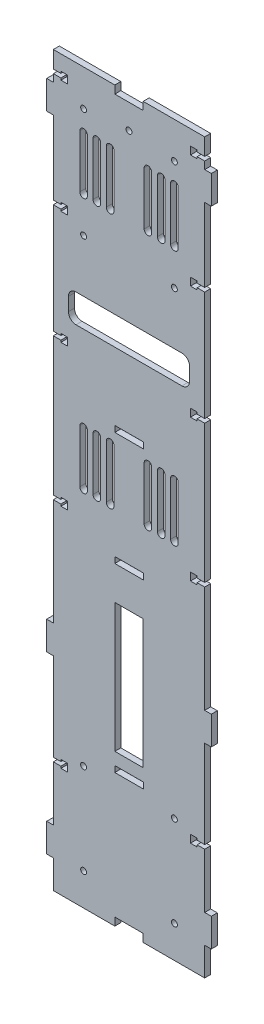
from build123d import *

# Parameters (mm, degrees)
SKETCH1_W                = 80
SKETCH1_H                = 385
BOSS_EXTRUDE1_DEPTH      = 3.175
SKETCH2_W                = 3.5
SKETCH2_H                = 15
BOSS_EXTRUDE2_DEPTH      = 3.175
CUT_EXTRUDE1_DEPTH       = 3.175
LPATTERN1_COUNT          = 2
LPATTERN1_PITCH          = 60
LPATTERN2_COUNT          = 2
LPATTERN2_PITCH          = 120
LPATTERN3_COUNT          = 2
LPATTERN3_PITCH          = 195
LPATTERN6_COUNT          = 2
LPATTERN6_PITCH          = 315
MIRROR2_COPY_1_DEPTH     = 3.175
MIRROR2_COPY_2_DEPTH     = 3.175
MIRROR2_COPY_3_DEPTH     = 3.175
MIRROR2_COPY_4_DEPTH     = 3.175
SKETCH7_W                = 15
SKETCH7_H                = 4.175
CUT_EXTRUDE2_DEPTH       = 10
SKETCH8_W                = 15
SKETCH8_H                = 3.175
CUT_EXTRUDE3_DEPTH       = 10
SKETCH9_W                = 15.1
SKETCH9_H                = 3.2
CUT_EXTRUDE4_DEPTH       = 350.137982215
SKETCH10_R               = 1.55
CUT_EXTRUDE5_DEPTH       = 10
SKETCH11_R               = 1.55
CUT_EXTRUDE6_DEPTH       = 350.137982215
CUT_EXTRUDE7_DEPTH       = 10
LPATTERN4_COUNT          = 3
LPATTERN4_PITCH          = 7
MIRROR4_COPY_1_DEPTH     = 10
MIRROR4_COPY_2_DEPTH     = 10
SKETCH14_R               = 1.55
CUT_EXTRUDE9_DEPTH       = 350.137982215
LPATTERN5_COUNT          = 2
LPATTERN5_PITCH          = 135
LPATTERN5_COPY_1_DEPTH   = 10
LPATTERN5_COPY_2_DEPTH   = 10
LPATTERN5_COPY_3_DEPTH   = 10
LPATTERN5_COPY_4_DEPTH   = 10
LPATTERN5_COPY_5_DEPTH   = 10
CUT_EXTRUDE10_DEPTH      = 350.137982215
LPATTERN7_COUNT          = 2
LPATTERN7_PITCH          = 60
CUT_EXTRUDE11_DEPTH      = 350.137982215
CUT_EXTRUDE11_DEPTH_BACK = 350.137982215
SKETCH17_W               = 15
SKETCH17_H               = 70
SKETCH18_W               = 15
SKETCH18_H               = 5
BOSS_EXTRUDE3_DEPTH      = 3.175
SKETCH19_W               = 15.1
SKETCH19_H               = 3.2
CUT_EXTRUDE12_DEPTH      = 350.137982215


with BuildPart() as part:
    # Sketch1 → Boss-Extrude1 (new body)
    with BuildSketch(Plane.XY):
        with Locations((-10, 152.5)):
            Rectangle(SKETCH1_W, SKETCH1_H)
    extrude(amount=-BOSS_EXTRUDE1_DEPTH)

    # Sketch2 → Boss-Extrude2 (add)
    with BuildSketch(Plane.XY):
        with Locations((-51.75, 322.5)):
            Rectangle(SKETCH2_W, SKETCH2_H)
        with Locations((-51.75, 75)):
            Rectangle(SKETCH2_W, SKETCH2_H)
        with Locations((-51.75, -17.5)):
            Rectangle(SKETCH2_W, SKETCH2_H)
    boss_extrude2 = extrude(amount=-BOSS_EXTRUDE2_DEPTH)

    # Sketch6 → Cut-Extrude1 (cut)
    with BuildSketch(Plane.XY):
        Polygon((-50, 336.05), (-46, 336.05), (-46, 337.05), (-42.5, 337.05), (-42.5, 332.95), (-46, 332.95), (-46, 333.95), (-50, 333.95), align=None)
    cut_extrude1 = extrude(amount=-CUT_EXTRUDE1_DEPTH, mode=Mode.SUBTRACT)

    # LPattern1: Cut-Extrude1 ×2
    with Locations(*[(0, -i * LPATTERN1_PITCH, 0) for i in range(1, LPATTERN1_COUNT)]):
        add(cut_extrude1, mode=Mode.SUBTRACT)

    # Mirror1: Boss-Extrude2 across plane
    add(boss_extrude2.mirror(Plane.ZY.offset(10)))

    # LPattern2: Cut-Extrude1 ×2
    with Locations(*[(0, -i * LPATTERN2_PITCH, 0) for i in range(1, LPATTERN2_COUNT)]):
        add(cut_extrude1, mode=Mode.SUBTRACT)

    # LPattern3: Cut-Extrude1 ×2
    with Locations(*[(0, -i * LPATTERN3_PITCH, 0) for i in range(1, LPATTERN3_COUNT)]):
        add(cut_extrude1, mode=Mode.SUBTRACT)

    # LPattern6: Cut-Extrude1 ×2
    with Locations(*[(0, -i * LPATTERN6_PITCH, 0) for i in range(1, LPATTERN6_COUNT)]):
        add(cut_extrude1, mode=Mode.SUBTRACT)

    # Mirror2: Cut-Extrude1 across plane
    add(cut_extrude1.mirror(Plane.ZY.offset(10)), mode=Mode.SUBTRACT)

    # Mirror2 copy 1 sketch → Mirror2 copy 1 (cut)
    with BuildSketch(Plane(origin=(-20, -60, 0), x_dir=(-1, 0, 0), z_dir=(0, 0, 1))):
        Polygon((-50, -336.05), (-46, -336.05), (-46, -337.05), (-42.5, -337.05), (-42.5, -332.95), (-46, -332.95), (-46, -333.95), (-50, -333.95), align=None)
    extrude(amount=-MIRROR2_COPY_1_DEPTH, mode=Mode.SUBTRACT)

    # Mirror2 copy 2 sketch → Mirror2 copy 2 (cut)
    with BuildSketch(Plane(origin=(-20, -120, 0), x_dir=(-1, 0, 0), z_dir=(0, 0, 1))):
        Polygon((-50, -336.05), (-46, -336.05), (-46, -337.05), (-42.5, -337.05), (-42.5, -332.95), (-46, -332.95), (-46, -333.95), (-50, -333.95), align=None)
    extrude(amount=-MIRROR2_COPY_2_DEPTH, mode=Mode.SUBTRACT)

    # Mirror2 copy 3 sketch → Mirror2 copy 3 (cut)
    with BuildSketch(Plane(origin=(-20, -195, 0), x_dir=(-1, 0, 0), z_dir=(0, 0, 1))):
        Polygon((-50, -336.05), (-46, -336.05), (-46, -337.05), (-42.5, -337.05), (-42.5, -332.95), (-46, -332.95), (-46, -333.95), (-50, -333.95), align=None)
    extrude(amount=-MIRROR2_COPY_3_DEPTH, mode=Mode.SUBTRACT)

    # Mirror2 copy 4 sketch → Mirror2 copy 4 (cut)
    with BuildSketch(Plane(origin=(-20, -315, 0), x_dir=(-1, 0, 0), z_dir=(0, 0, 1))):
        Polygon((-50, -336.05), (-46, -336.05), (-46, -337.05), (-42.5, -337.05), (-42.5, -332.95), (-46, -332.95), (-46, -333.95), (-50, -333.95), align=None)
    extrude(amount=-MIRROR2_COPY_4_DEPTH, mode=Mode.SUBTRACT)

    # Sketch7 → Cut-Extrude2 (cut)
    with BuildSketch(Plane.XY):
        with Locations((-10, 342.9125)):
            Rectangle(SKETCH7_W, SKETCH7_H)
        with Locations((-10, -37.9125)):
            Rectangle(SKETCH7_W, SKETCH7_H)
    extrude(amount=-CUT_EXTRUDE2_DEPTH, mode=Mode.SUBTRACT)

    # Sketch8 → Cut-Extrude3 (cut)
    with BuildSketch(Plane.XY):
        with Locations((-10, 36.5875)):
            Rectangle(SKETCH8_W, SKETCH8_H)
    extrude(amount=-CUT_EXTRUDE3_DEPTH, mode=Mode.SUBTRACT)

    # Sketch9 → Cut-Extrude4 (cut, through all)
    with BuildSketch(Plane.XY):
        with Locations((-9.95, 127.575)):
            Rectangle(SKETCH9_W, SKETCH9_H)
    cut_extrude4 = extrude(amount=-CUT_EXTRUDE4_DEPTH, mode=Mode.SUBTRACT)

    # Sketch10 → Cut-Extrude5 (cut)
    with BuildSketch(Plane.XY):
        with Locations((-34, 25)):
            Circle(SKETCH10_R)
        with Locations((-34, -23)):
            Circle(SKETCH10_R)
        with Locations((14, 25)):
            Circle(SKETCH10_R)
        with Locations((14, -23)):
            Circle(SKETCH10_R)
    extrude(amount=-CUT_EXTRUDE5_DEPTH, mode=Mode.SUBTRACT)

    # Sketch11 → Cut-Extrude6 (cut, through all)
    with BuildSketch(Plane.XY):
        with Locations((-34, 325.825)):
            Circle(SKETCH11_R)
        with Locations((-34, 267.825)):
            Circle(SKETCH11_R)
        with Locations((14, 325.825)):
            Circle(SKETCH11_R)
        with Locations((14, 267.825)):
            Circle(SKETCH11_R)
    extrude(amount=-CUT_EXTRUDE6_DEPTH, mode=Mode.SUBTRACT)

    # Sketch12 → Cut-Extrude7 (cut)
    with BuildSketch(Plane.XY):
        with BuildLine():
            Line((-2, 286.825), (-2, 314.825))
            ThreePointArc((-2, 314.825), (0, 316.825), (2, 314.825))
            Line((2, 314.825), (2, 286.825))
            ThreePointArc((2, 286.825), (0, 284.825), (-2, 286.825))
        make_face()
    cut_extrude7 = extrude(amount=-CUT_EXTRUDE7_DEPTH, mode=Mode.SUBTRACT)

    # LPattern4: Cut-Extrude7 ×3
    with Locations(*[(i * LPATTERN4_PITCH, 0, 0) for i in range(1, LPATTERN4_COUNT)]):
        add(cut_extrude7, mode=Mode.SUBTRACT)

    # Mirror4: Cut-Extrude7 across plane
    add(cut_extrude7.mirror(Plane.ZY.offset(10)), mode=Mode.SUBTRACT)

    # Mirror4 copy 1 sketch → Mirror4 copy 1 (cut)
    with BuildSketch(Plane(origin=(-27, 0, 0), x_dir=(-1, 0, 0), z_dir=(0, 0, 1))):
        with BuildLine():
            Line((-2, -286.825), (-2, -314.825))
            ThreePointArc((-2, -314.825), (0, -316.825), (2, -314.825))
            Line((2, -314.825), (2, -286.825))
            ThreePointArc((2, -286.825), (0, -284.825), (-2, -286.825))
        make_face()
    extrude(amount=-MIRROR4_COPY_1_DEPTH, mode=Mode.SUBTRACT)

    # Mirror4 copy 2 sketch → Mirror4 copy 2 (cut)
    with BuildSketch(Plane(origin=(-34, 0, 0), x_dir=(-1, 0, 0), z_dir=(0, 0, 1))):
        with BuildLine():
            Line((-2, -286.825), (-2, -314.825))
            ThreePointArc((-2, -314.825), (0, -316.825), (2, -314.825))
            Line((2, -314.825), (2, -286.825))
            ThreePointArc((2, -286.825), (0, -284.825), (-2, -286.825))
        make_face()
    extrude(amount=-MIRROR4_COPY_2_DEPTH, mode=Mode.SUBTRACT)

    # Sketch14 → Cut-Extrude9 (cut, through all)
    with BuildSketch(Plane.XY):
        with Locations((-10, 327.825)):
            Circle(SKETCH14_R)
    extrude(amount=-CUT_EXTRUDE9_DEPTH, mode=Mode.SUBTRACT)

    # LPattern5: Cut-Extrude7 ×2
    with Locations(*[(0, -i * LPATTERN5_PITCH, 0) for i in range(1, LPATTERN5_COUNT)]):
        add(cut_extrude7, mode=Mode.SUBTRACT)

    # LPattern5 copy 1 sketch → LPattern5 copy 1 (cut)
    with BuildSketch(Plane(origin=(7, -135, 0), x_dir=(1, 0, 0), z_dir=(0, 0, 1))):
        with BuildLine():
            Line((-2, 286.825), (-2, 314.825))
            ThreePointArc((-2, 314.825), (0, 316.825), (2, 314.825))
            Line((2, 314.825), (2, 286.825))
            ThreePointArc((2, 286.825), (0, 284.825), (-2, 286.825))
        make_face()
    extrude(amount=-LPATTERN5_COPY_1_DEPTH, mode=Mode.SUBTRACT)

    # LPattern5 copy 2 sketch → LPattern5 copy 2 (cut)
    with BuildSketch(Plane(origin=(14, -135, 0), x_dir=(1, 0, 0), z_dir=(0, 0, 1))):
        with BuildLine():
            Line((-2, 286.825), (-2, 314.825))
            ThreePointArc((-2, 314.825), (0, 316.825), (2, 314.825))
            Line((2, 314.825), (2, 286.825))
            ThreePointArc((2, 286.825), (0, 284.825), (-2, 286.825))
        make_face()
    extrude(amount=-LPATTERN5_COPY_2_DEPTH, mode=Mode.SUBTRACT)

    # LPattern5 copy 3 sketch → LPattern5 copy 3 (cut)
    with BuildSketch(Plane(origin=(-20, -135, 0), x_dir=(-1, 0, 0), z_dir=(0, 0, 1))):
        with BuildLine():
            Line((-2, -286.825), (-2, -314.825))
            ThreePointArc((-2, -314.825), (0, -316.825), (2, -314.825))
            Line((2, -314.825), (2, -286.825))
            ThreePointArc((2, -286.825), (0, -284.825), (-2, -286.825))
        make_face()
    extrude(amount=-LPATTERN5_COPY_3_DEPTH, mode=Mode.SUBTRACT)

    # LPattern5 copy 4 sketch → LPattern5 copy 4 (cut)
    with BuildSketch(Plane(origin=(-27, -135, 0), x_dir=(-1, 0, 0), z_dir=(0, 0, 1))):
        with BuildLine():
            Line((-2, -286.825), (-2, -314.825))
            ThreePointArc((-2, -314.825), (0, -316.825), (2, -314.825))
            Line((2, -314.825), (2, -286.825))
            ThreePointArc((2, -286.825), (0, -284.825), (-2, -286.825))
        make_face()
    extrude(amount=-LPATTERN5_COPY_4_DEPTH, mode=Mode.SUBTRACT)

    # LPattern5 copy 5 sketch → LPattern5 copy 5 (cut)
    with BuildSketch(Plane(origin=(-34, -135, 0), x_dir=(-1, 0, 0), z_dir=(0, 0, 1))):
        with BuildLine():
            Line((-2, -286.825), (-2, -314.825))
            ThreePointArc((-2, -314.825), (0, -316.825), (2, -314.825))
            Line((2, -314.825), (2, -286.825))
            ThreePointArc((2, -286.825), (0, -284.825), (-2, -286.825))
        make_face()
    extrude(amount=-LPATTERN5_COPY_5_DEPTH, mode=Mode.SUBTRACT)

    # Sketch15 → Cut-Extrude10 (cut, through all)
    with BuildSketch(Plane.XY):
        with BuildLine():
            Line((-38, 240), (18, 240))
            ThreePointArc((18, 240), (20.828427125, 238.828427125), (22, 236))
            Line((22, 236), (22, 229))
            ThreePointArc((22, 229), (20.828427125, 226.171572875), (18, 225))
            Line((18, 225), (-38, 225))
            ThreePointArc((-38, 225), (-40.828427125, 226.171572875), (-42, 229))
            Line((-42, 229), (-42, 236))
            ThreePointArc((-42, 236), (-40.828427125, 238.828427125), (-38, 240))
        make_face()
    extrude(amount=-CUT_EXTRUDE10_DEPTH, mode=Mode.SUBTRACT)

    # LPattern7: Cut-Extrude4 ×2
    with Locations(*[(0, i * LPATTERN7_PITCH, 0) for i in range(1, LPATTERN7_COUNT)]):
        add(cut_extrude4, mode=Mode.SUBTRACT)

    # Sketch17 → Cut-Extrude11 (cut, two sides: drawn at the far end of the back side and taken through both)
    with BuildSketch(Plane.XY.offset(-CUT_EXTRUDE11_DEPTH_BACK)):
        with Locations((-10, 73.175)):
            Rectangle(SKETCH17_W, SKETCH17_H)
    extrude(amount=CUT_EXTRUDE11_DEPTH + CUT_EXTRUDE11_DEPTH_BACK, mode=Mode.SUBTRACT)

    # Sketch18 → Boss-Extrude3 (add)
    with BuildSketch(Plane.XY):
        with Locations((-10, 37.5)):
            Rectangle(SKETCH18_W, SKETCH18_H)
    extrude(amount=-BOSS_EXTRUDE3_DEPTH)

    # Sketch19 → Cut-Extrude12 (cut, through all)
    with BuildSketch(Plane.XY):
        with Locations((-9.95, 31.9)):
            Rectangle(SKETCH19_W, SKETCH19_H)
    extrude(amount=-CUT_EXTRUDE12_DEPTH, mode=Mode.SUBTRACT)


solid = part.part
